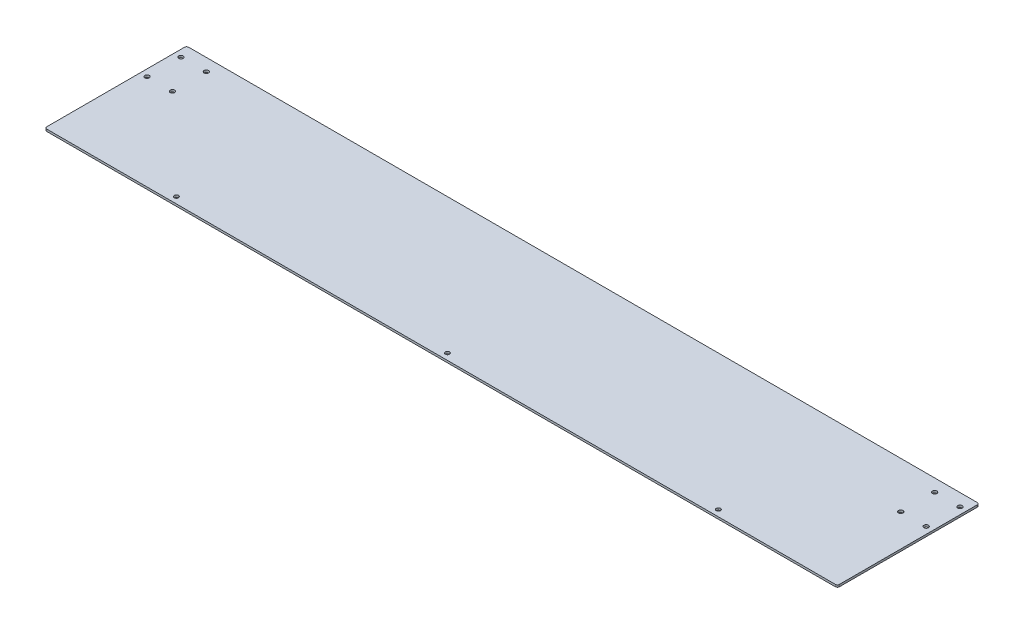
from build123d import *

# Parameters (mm, degrees)
BOSS_EXTRUDE1_DEPTH              = 3.175
F_1_4_0_25_DIAMETER_HOLE1_D      = 6.35
F_17_64_0_26563_DIAMETER_HOLE2_D = 6.747002


with BuildPart() as part:
    # Sketch1 → Boss-Extrude1 (new body)
    with BuildSketch(Plane(origin=(0, 0, 0), x_dir=(1, 0, 0), z_dir=(0, 1, 0))):
        with BuildLine():
            Line((-591.185, -106.3625), (591.185, -106.3625))
            ThreePointArc((591.185, -106.3625), (593.43006403, -105.43256403), (594.36, -103.1875))
            Line((594.36, -103.1875), (594.36, 103.1875))
            ThreePointArc((594.36, 103.1875), (593.43006403, 105.43256403), (591.185, 106.3625))
            Line((591.185, 106.3625), (-591.185, 106.3625))
            ThreePointArc((-591.185, 106.3625), (-593.43006403, 105.43256403), (-594.36, 103.1875))
            Line((-594.36, 103.1875), (-594.36, -103.1875))
            ThreePointArc((-594.36, -103.1875), (-593.43006403, -105.43256403), (-591.185, -106.3625))
        make_face()
    extrude(amount=BOSS_EXTRUDE1_DEPTH)

    # 1/4 (0.25) Diameter Hole1 (through all)
    with Locations(Plane(origin=(0, 3.175, 0), x_dir=(1, 0, 0), z_dir=(0, 1, 0))):
        with Locations((0, -96.8375), (-406.4, -96.8375), (406.4, -96.8375)):
            Hole(F_1_4_0_25_DIAMETER_HOLE1_D / 2)

    # 17/64 (0.26563) Diameter Hole2 (through all)
    with Locations(Plane(origin=(0, 3.175, 0), x_dir=(1, 0, 0), z_dir=(0, 1, 0))):
        with Locations((-546.1, 36.90874), (-546.1, 87.70874), (-584.2, 87.70874), (-584.2, 36.90874), (584.2, 36.90874), (546.1, 36.90874), (546.1, 87.70874), (584.2, 87.70874)):
            Hole(F_17_64_0_26563_DIAMETER_HOLE2_D / 2)


solid = part.part
